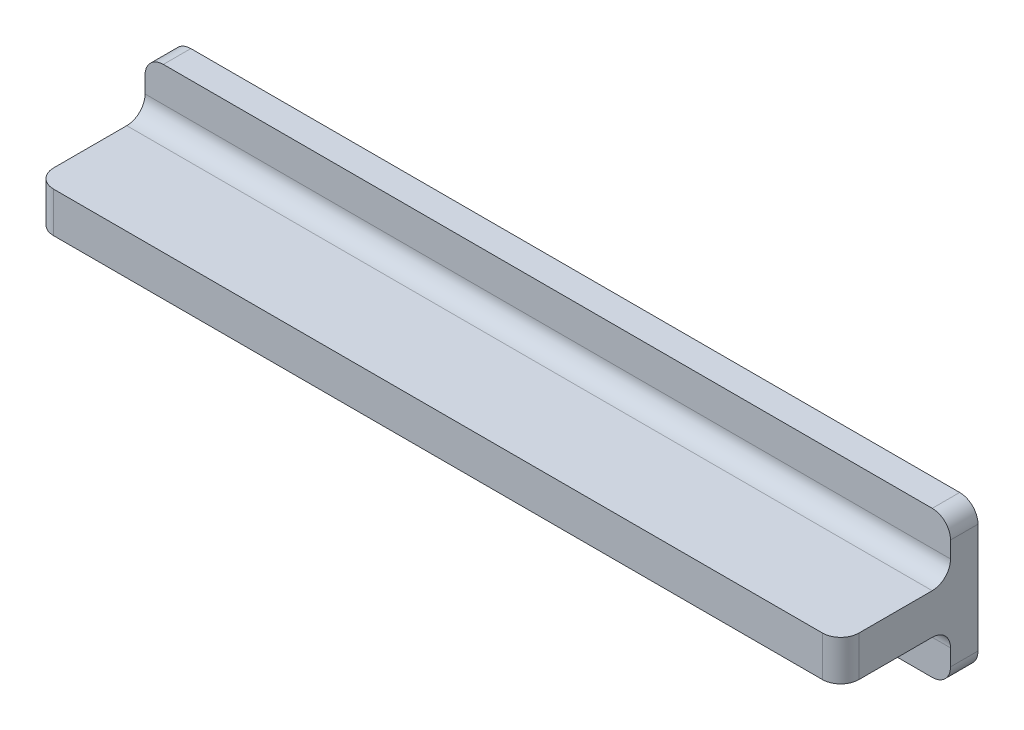
from build123d import *

# Parameters (mm, degrees)
SKETCH1_W           = 139.7
SKETCH1_H           = 25.4
BOSS_EXTRUDE1_DEPTH = 4.7625
SKETCH2_W           = 139.7
SKETCH2_H           = 7
BOSS_EXTRUDE2_DEPTH = 19.05
FILLET1_R           = 3.175


with BuildPart() as part:
    # Sketch1 → Boss-Extrude1 (new body)
    with BuildSketch(Plane.XY):
        Rectangle(SKETCH1_W, SKETCH1_H)
    extrude(amount=BOSS_EXTRUDE1_DEPTH)

    # Sketch2 → Boss-Extrude2 (add)
    with BuildSketch(Plane.XY.offset(4.7625)):
        Rectangle(SKETCH2_W, SKETCH2_H)
    extrude(amount=BOSS_EXTRUDE2_DEPTH)

    # Fillet1
    fillet1_edges = [part.edges().sort_by_distance(p)[0] for p in [
        (0, 3.5, 4.7625),
        (0, -3.5, 4.7625),
        (69.85, 0, 23.8125),
        (-69.85, 0, 23.8125),
        (69.85, -12.7, 2.38125),
        (-69.85, -12.7, 2.38125),
        (-69.85, 12.7, 2.38125),
        (69.85, 12.7, 2.38125),
    ]]
    fillet(fillet1_edges, radius=FILLET1_R)


solid = part.part
